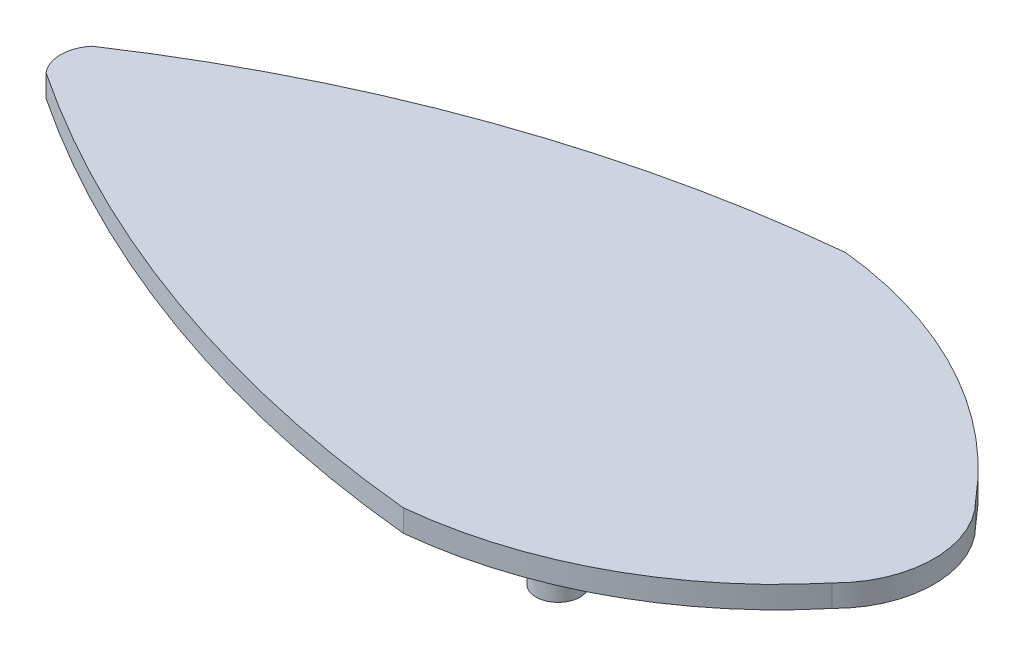
from build123d import *

# Parameters (mm, degrees)
SALIENTE_EXTRUIR1_DEPTH = 6.35
SALIENTE_EXTRUIR2_START = -6.35
CROQUIS2_R              = 6.35
SALIENTE_EXTRUIR2_DEPTH = 6.35


with BuildPart() as part:
    # Croquis1 → Saliente-Extruir1 (new body)
    with BuildSketch(Plane(origin=(0, 0, 0), x_dir=(1, 0, 0), z_dir=(0, 1, 0))):
        with BuildLine():
            ThreePointArc((-159.524805442, 6.609301122), (-83.260417422, 44.863285815), (0, 63.5))
            ThreePointArc((0, 63.5), (44.339000485, 49.930204678), (80.270138251, 20.620826521))
            ThreePointArc((80.270138251, 20.620826521), (88.9, 0), (80.270138251, -20.620826521))
            ThreePointArc((80.270138251, -20.620826521), (44.339000485, -49.930204678), (0, -63.5))
            ThreePointArc((0, -63.5), (-83.260417422, -44.863285815), (-159.524805442, -6.609301122))
            ThreePointArc((-159.524805442, -6.609301122), (-161.925, 0), (-159.524805442, 6.609301122))
        make_face()
    extrude(amount=SALIENTE_EXTRUIR1_DEPTH)

    # Croquis2 → Saliente-Extruir2 (add)
    with BuildSketch(Plane(origin=(0, 6.35, 0), x_dir=(1, 0, 0), z_dir=(0, 1, 0)).offset(SALIENTE_EXTRUIR2_START)):
        with Locations(Location((28.575, 47.625, 0), (0, 0, 270))):
            Circle(CROQUIS2_R)
        with Locations(Location((28.575, -47.625, 0), (0, 0, 270))):
            Circle(CROQUIS2_R)
        with Locations(Location((-136.525, 0, 0), (0, 0, 270))):
            Circle(CROQUIS2_R)
    extrude(amount=-SALIENTE_EXTRUIR2_DEPTH)


solid = part.part
